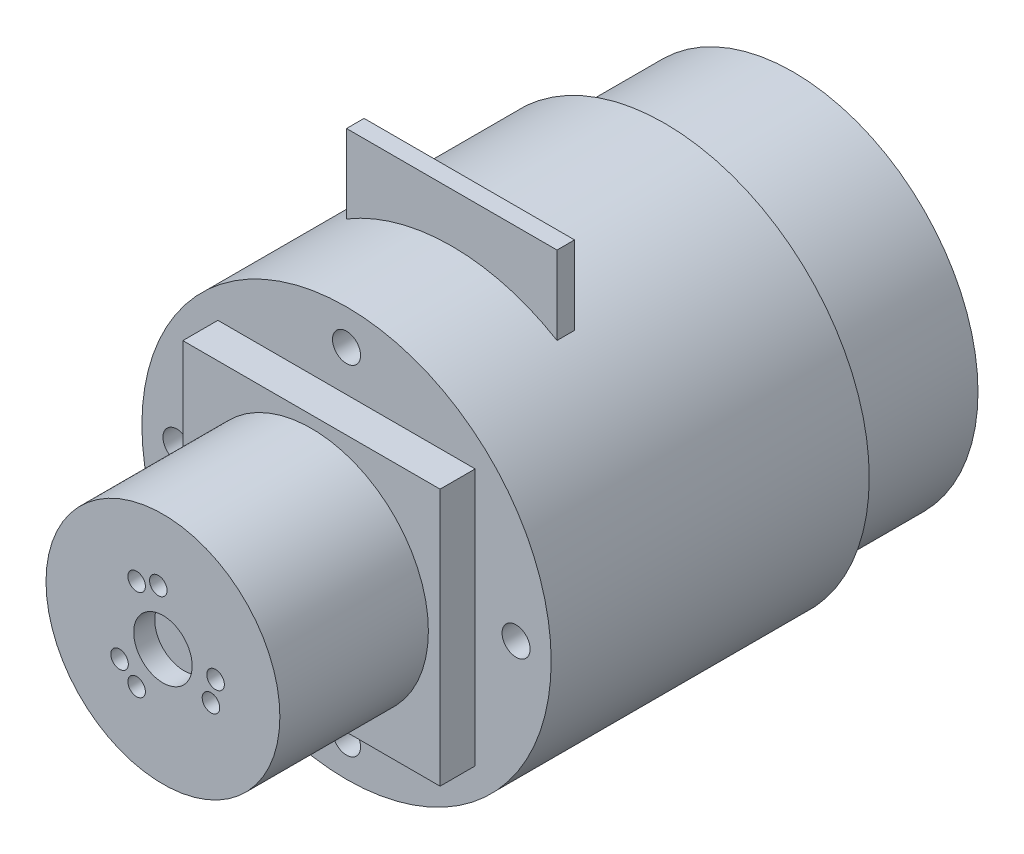
from build123d import *

# Parameters (mm, degrees)
SKETCH_1_R          = 17.5
EXTRUDE_1_DEPTH     = 27.2
SKETCH_2_R          = 15.8
EXTRUDE_2_DEPTH     = 11
SKETCH_3_W          = 22
SKETCH_3_H          = 22
EXTRUDE_3_DEPTH     = 3
SKETCH_4_R          = 10
EXTRUDE_4_DEPTH     = 12.7
SKETCH_5_R          = 1.2
CUT_EXTRUDE_1_DEPTH = 10
EXTRUDE_START       = -1.5
EXTRUDE_5_DEPTH     = 1.5
SKETCH_8_R          = 2.5
CUT_EXTRUDE_2_DEPTH = 1.8
SKETCH_9_R          = 0.75
CUT_EXTRUDE_3_DEPTH = 2


with BuildPart() as part:
    # 草图1 → 凸台-拉伸1 (new body)
    with BuildSketch(Plane.XY):
        Circle(SKETCH_1_R)
    extrude(amount=EXTRUDE_1_DEPTH)

    # 草图2 → 凸台-拉伸2 (add)
    with BuildSketch(Plane(origin=(0, 0, 0), x_dir=(-1, 0, 0), z_dir=(0, 0, -1))):
        with Locations(Location((0, 0, 0), (0, 0, 180))):
            Circle(SKETCH_2_R)
    extrude(amount=EXTRUDE_2_DEPTH)

    # 草图3 → 凸台-拉伸3 (add)
    with BuildSketch(Plane.XY.offset(27.2)):
        Rectangle(SKETCH_3_W, SKETCH_3_H)
    extrude(amount=EXTRUDE_3_DEPTH)

    # 草图4 → 凸台-拉伸4 (add)
    with BuildSketch(Plane.XY.offset(30.2)):
        with Locations(Location((0, 0, 0), (0, 0, 180))):
            Circle(SKETCH_4_R)
    extrude(amount=EXTRUDE_4_DEPTH)

    # 草图5 → 切除-拉伸1 (cut)
    with BuildSketch(Plane.XY.offset(27.2)):
        with Locations((0, -14.5)):
            Circle(SKETCH_5_R)
        with Locations((-14.5, 0)):
            Circle(SKETCH_5_R)
        with Locations((0, 14.5)):
            Circle(SKETCH_5_R)
        with Locations((14.5, 0)):
            Circle(SKETCH_5_R)
    extrude(amount=-CUT_EXTRUDE_1_DEPTH, mode=Mode.SUBTRACT)

    # 草图6 → 凸台-拉伸5 (add)
    with BuildSketch(Plane.XY.offset(18.2).offset(EXTRUDE_START)):
        with BuildLine():
            Line((-9, 15.00833102), (-9, 21.70833102))
            Line((-9, 21.70833102), (9, 21.70833102))
            Line((9, 21.70833102), (9, 15.00833102))
            ThreePointArc((9, 15.00833102), (0, 17.5), (-9, 15.00833102))
        make_face()
    extrude(amount=EXTRUDE_5_DEPTH)

    # 草图8 → 切除-拉伸2 (cut)
    with BuildSketch(Plane.XY.offset(42.9)):
        Circle(SKETCH_8_R)
    extrude(amount=-CUT_EXTRUDE_2_DEPTH, mode=Mode.SUBTRACT)

    # 草图9 → 切除-拉伸3 (cut)
    with BuildSketch(Plane.XY.offset(42.9)):
        with Locations((4.5, 0)):
            Circle(SKETCH_9_R)
        with Locations((4.106443914, -1.914866245)):
            Circle(SKETCH_9_R)
        with Locations((-2.25, -3.897114317)):
            Circle(SKETCH_9_R)
        with Locations((-3.71154477, -2.598851626)):
            Circle(SKETCH_9_R)
        with Locations((-2.25, 3.897114317)):
            Circle(SKETCH_9_R)
        with Locations((-0.394899144, 4.513717871)):
            Circle(SKETCH_9_R)
    extrude(amount=-CUT_EXTRUDE_3_DEPTH, mode=Mode.SUBTRACT)


solid = part.part
